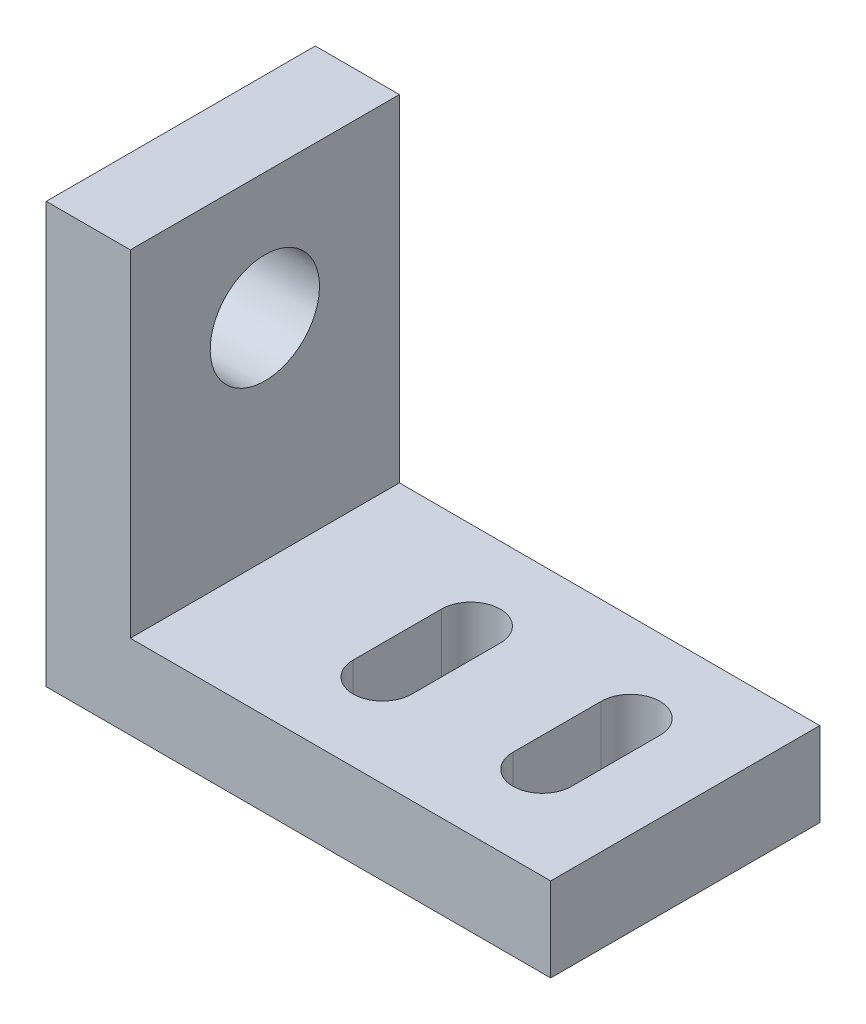
from build123d import *

# Parameters (mm, degrees)
ESTRUSIONE_ESTRUSIONE1_DEPTH = 16
SCHIZZO2_R                   = 3.25
TAGLIO_ESTRUSIONE1_DEPTH     = 4
TAGLIO_ESTRUSIONE2_DEPTH     = 4
SCHIZZO4_R                   = 3.25
TAGLIO_ESTRUSIONE3_DEPTH     = 3
TAGLIO_ESTRUSIONE5_DEPTH     = 3


with BuildPart() as part:
    # Schizzo1 → Estrusione-Estrusione1 (new body)
    with BuildSketch(Plane.XY):
        Polygon((0, 20), (0, 0), (25, 0), (25, -5), (-5, -5), (-5, 20), align=None)
    extrude(amount=ESTRUSIONE_ESTRUSIONE1_DEPTH)

    # Schizzo2 → Taglio-Estrusione1 (cut)
    with BuildSketch(Plane(origin=(0, 0, 0), x_dir=(0, 0, -1), z_dir=(1, 0, 0))):
        with Locations(Location((-8, 12.5, 0), (0, 0, 90))):
            Circle(SCHIZZO2_R)
    extrude(amount=-TAGLIO_ESTRUSIONE1_DEPTH, mode=Mode.SUBTRACT)

    # Schizzo3 → Taglio-Estrusione2 (cut)
    with BuildSketch(Plane(origin=(0, 0, 0), x_dir=(1, 0, 0), z_dir=(0, 1, 0))):
        with BuildLine():
            Line((17.25, -5.25), (17.25, -10.5))
            ThreePointArc((17.25, -10.5), (19, -12.25), (20.75, -10.5))
            Line((20.75, -10.5), (20.75, -5.25))
            ThreePointArc((20.75, -5.25), (19, -3.5), (17.25, -5.25))
        make_face()
        with BuildLine():
            Line((7.75, -5.25), (7.75, -10.5))
            ThreePointArc((7.75, -10.5), (9.5, -12.25), (11.25, -10.5))
            Line((11.25, -10.5), (11.25, -5.25))
            ThreePointArc((11.25, -5.25), (9.5, -3.5), (7.75, -5.25))
        make_face()
    extrude(amount=-TAGLIO_ESTRUSIONE2_DEPTH, mode=Mode.SUBTRACT)

    # Schizzo4 → Taglio-Estrusione3 (cut)
    with BuildSketch(Plane(origin=(-4, 0, 0), x_dir=(0, 0, -1), z_dir=(1, 0, 0))):
        with Locations(Location((-8, 12.5, 0), (0, 0, 90))):
            Circle(SCHIZZO4_R)
    extrude(amount=-TAGLIO_ESTRUSIONE3_DEPTH, mode=Mode.SUBTRACT)

    # Schizzo5 → Taglio-Estrusione5 (cut)
    with BuildSketch(Plane(origin=(0, -4, 0), x_dir=(1, 0, 0), z_dir=(0, 1, 0))):
        with BuildLine():
            Line((11.268981919, -5.25), (11.268981919, -10.5))
            ThreePointArc((11.268981919, -10.5), (9.5, -12.268981919), (7.731018081, -10.5))
            Line((7.731018081, -10.5), (7.731018081, -5.25))
            ThreePointArc((7.731018081, -5.25), (9.5, -3.481018081), (11.268981919, -5.25))
        make_face()
        with BuildLine():
            Line((20.769481266, -5.25), (20.769481266, -10.5))
            ThreePointArc((20.769481266, -10.5), (19.000499347, -12.268981919), (17.231517428, -10.5))
            Line((17.231517428, -10.5), (17.231517428, -5.25))
            ThreePointArc((17.231517428, -5.25), (19.000499347, -3.481018081), (20.769481266, -5.25))
        make_face()
    extrude(amount=-TAGLIO_ESTRUSIONE5_DEPTH, mode=Mode.SUBTRACT)


solid = part.part
